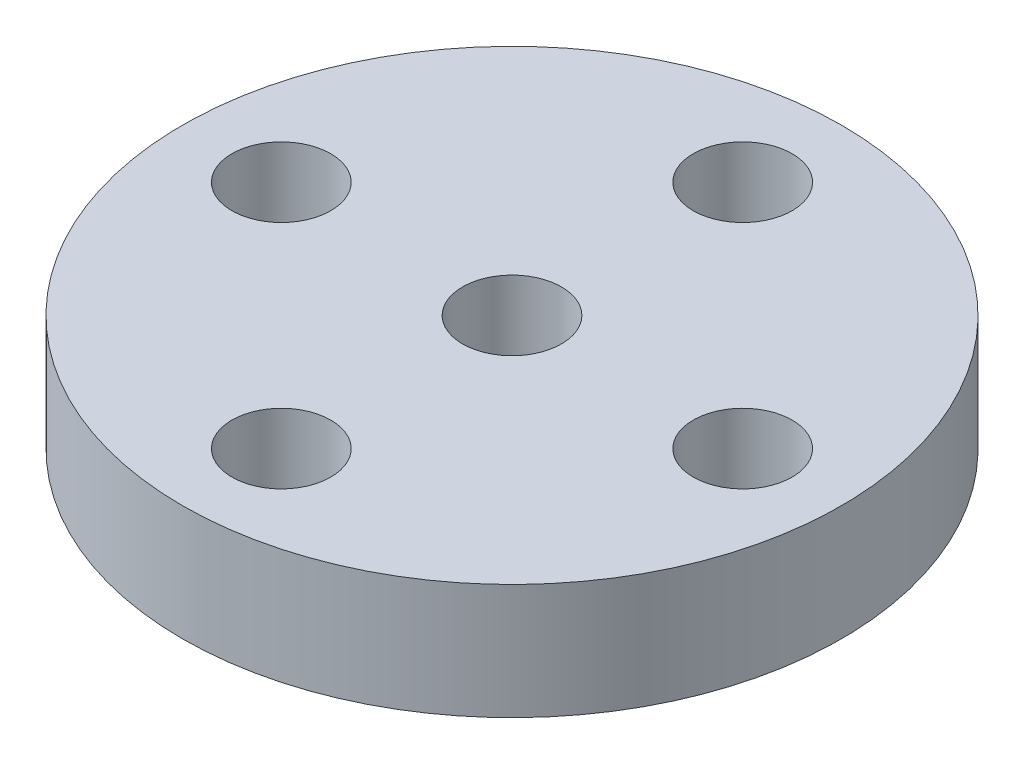
from build123d import *

# Parameters (mm, degrees)
SKETCH_1_R      = 10
SKETCH_1_R_2    = 1.5
EXTRUDE_1_DEPTH = 3.5


with BuildPart() as part:
    # 草图1 → 凸台-拉伸1 (new body)
    with BuildSketch(Plane(origin=(0, 0, 0), x_dir=(1, 0, 0), z_dir=(0, 1, 0))):
        with Locations(Location((0, 0, 0), (0, 0, 270))):
            Circle(SKETCH_1_R)
        with Locations(Location((0, 7, 0), (0, 0, 270))):
            Circle(SKETCH_1_R_2, mode=Mode.SUBTRACT)
        with Locations(Location((7, 0, 0), (0, 0, 270))):
            Circle(SKETCH_1_R_2, mode=Mode.SUBTRACT)
        with Locations(Location((0, 0, 0), (0, 0, 270))):
            Circle(SKETCH_1_R_2, mode=Mode.SUBTRACT)
        with Locations(Location((0, -7, 0), (0, 0, 90))):
            Circle(SKETCH_1_R_2, mode=Mode.SUBTRACT)
        with Locations(Location((-7, 0, 0), (0, 0, 90))):
            Circle(SKETCH_1_R_2, mode=Mode.SUBTRACT)
    extrude(amount=EXTRUDE_1_DEPTH)


solid = part.part
